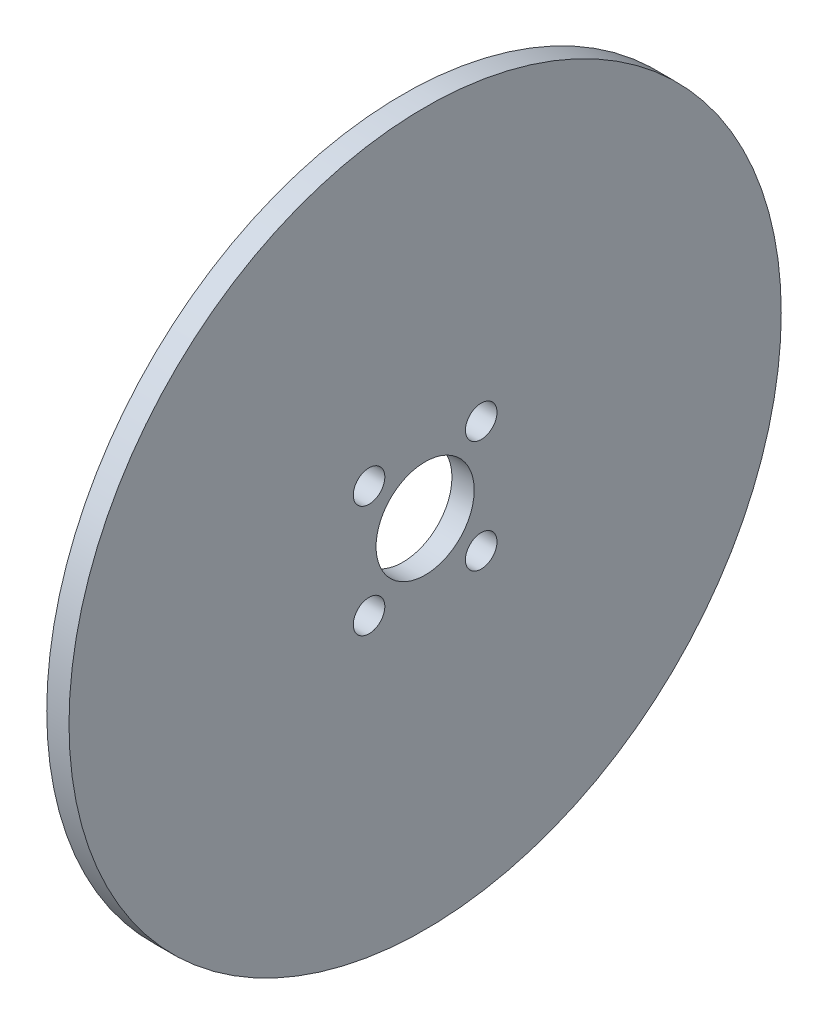
from build123d import *

# Parameters (mm, degrees)
SKETCH1_R           = 50.8
SKETCH1_R_2         = 7
BOSS_EXTRUDE2_DEPTH = 3.175
SKETCH2_R           = 2.25
CUT_EXTRUDE1_DEPTH  = 3.175


with BuildPart() as part:
    # Sketch1 → Boss-Extrude2 (new body)
    with BuildSketch(Plane.YZ):
        with Locations(Location((0, 0, 0), (0, 0, 270))):
            Circle(SKETCH1_R)
        with Locations(Location((0, 0, 0), (0, 0, 270))):
            Circle(SKETCH1_R_2, mode=Mode.SUBTRACT)
    extrude(amount=BOSS_EXTRUDE2_DEPTH)

    # Sketch2 → Cut-Extrude1 (cut)
    with BuildSketch(Plane.YZ.offset(3.175)):
        with Locations(Location((-8, 8, 0), (0, 0, 270))):
            Circle(SKETCH2_R)
        with Locations(Location((8, 8, 0), (0, 0, 270))):
            Circle(SKETCH2_R)
        with Locations(Location((8, -8, 0), (0, 0, 270))):
            Circle(SKETCH2_R)
        with Locations(Location((-8, -8, 0), (0, 0, 270))):
            Circle(SKETCH2_R)
    extrude(amount=-CUT_EXTRUDE1_DEPTH, mode=Mode.SUBTRACT)


solid = part.part
